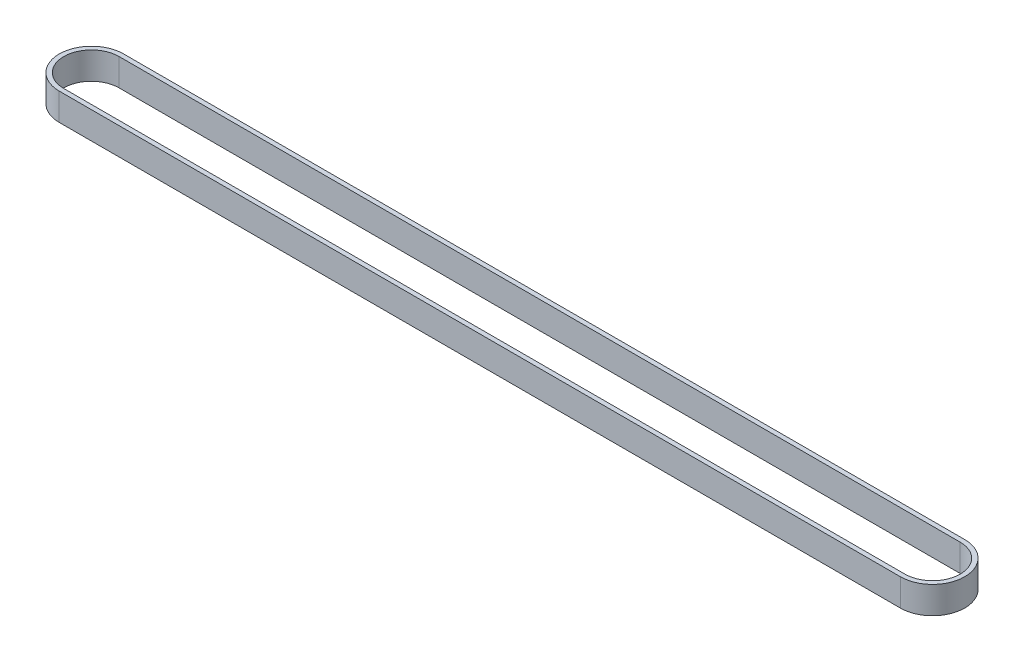
from build123d import *

# Parameters (mm, degrees)
BOSS_EXTRUDE1_DEPTH = 6


with BuildPart() as part:
    # Sketch1 → Boss-Extrude1 (new body)
    with BuildSketch(Plane(origin=(0, 0, 0), x_dir=(1, 0, 0), z_dir=(0, 1, 0))):
        with BuildLine():
            Line((0, 7.11), (185.798585701, 7.11))
            ThreePointArc((185.798585701, 7.11), (192.908585701, 0), (185.798585701, -7.11))
            Line((185.798585701, -7.11), (0, -7.11))
            ThreePointArc((0, -7.11), (-7.11, 0), (0, 7.11))
        make_face()
        with BuildLine():
            Line((0, 6.112197724), (185.798585701, 6.112197724))
            ThreePointArc((185.798585701, 6.112197724), (191.910783425, 0), (185.798585701, -6.112197724))
            Line((185.798585701, -6.112197724), (0, -6.112197724))
            ThreePointArc((0, -6.112197724), (-6.112197724, 0), (0, 6.112197724))
        make_face(mode=Mode.SUBTRACT)
    extrude(amount=BOSS_EXTRUDE1_DEPTH)


solid = part.part
